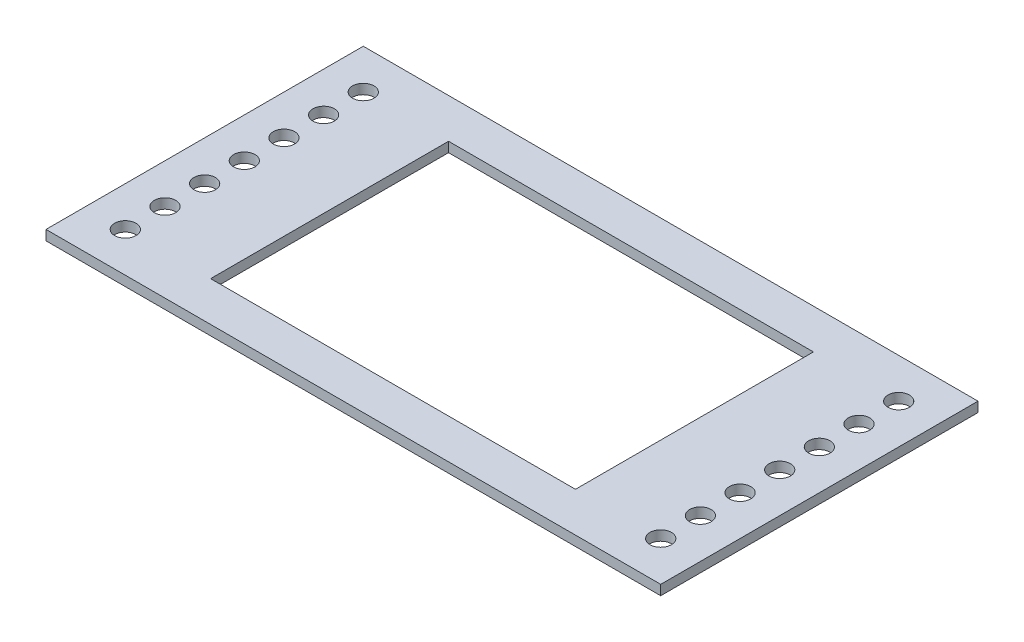
from build123d import *

# Parameters (mm, degrees)
SKETCH1_W           = 196.85
SKETCH1_H           = 101.6
SKETCH1_R           = 3.429
SKETCH1_W_2         = 116.84
SKETCH1_H_2         = 76.2
BOSS_EXTRUDE1_DEPTH = 3.175


with BuildPart() as part:
    # Sketch1 → Boss-Extrude1 (new body)
    with BuildSketch(Plane(origin=(0, 0, 0), x_dir=(1, 0, 0), z_dir=(0, 1, 0))):
        Rectangle(SKETCH1_W, SKETCH1_H)
        with Locations(Location((-85.725, 38.1, 0), (0, 0, 270))):
            Circle(SKETCH1_R, mode=Mode.SUBTRACT)
        with Locations(Location((85.725, 38.1, 0), (0, 0, 270))):
            Circle(SKETCH1_R, mode=Mode.SUBTRACT)
        with Locations(Location((85.725, 25.4, 0), (0, 0, 270))):
            Circle(SKETCH1_R, mode=Mode.SUBTRACT)
        with Locations(Location((85.725, 12.7, 0), (0, 0, 270))):
            Circle(SKETCH1_R, mode=Mode.SUBTRACT)
        with Locations(Location((85.725, 0, 0), (0, 0, 270))):
            Circle(SKETCH1_R, mode=Mode.SUBTRACT)
        with Locations(Location((85.725, -12.7, 0), (0, 0, 270))):
            Circle(SKETCH1_R, mode=Mode.SUBTRACT)
        with Locations(Location((85.725, -25.4, 0), (0, 0, 270))):
            Circle(SKETCH1_R, mode=Mode.SUBTRACT)
        with Locations(Location((85.725, -38.1, 0), (0, 0, 270))):
            Circle(SKETCH1_R, mode=Mode.SUBTRACT)
        with Locations(Location((-85.725, 25.4, 0), (0, 0, 270))):
            Circle(SKETCH1_R, mode=Mode.SUBTRACT)
        with Locations(Location((-85.725, 12.7, 0), (0, 0, 270))):
            Circle(SKETCH1_R, mode=Mode.SUBTRACT)
        with Locations(Location((-85.725, 0, 0), (0, 0, 270))):
            Circle(SKETCH1_R, mode=Mode.SUBTRACT)
        with Locations(Location((-85.725, -12.7, 0), (0, 0, 270))):
            Circle(SKETCH1_R, mode=Mode.SUBTRACT)
        with Locations(Location((-85.725, -25.4, 0), (0, 0, 270))):
            Circle(SKETCH1_R, mode=Mode.SUBTRACT)
        with Locations(Location((-85.725, -38.1, 0), (0, 0, 270))):
            Circle(SKETCH1_R, mode=Mode.SUBTRACT)
        Rectangle(SKETCH1_W_2, SKETCH1_H_2, mode=Mode.SUBTRACT)
    extrude(amount=BOSS_EXTRUDE1_DEPTH)


solid = part.part
